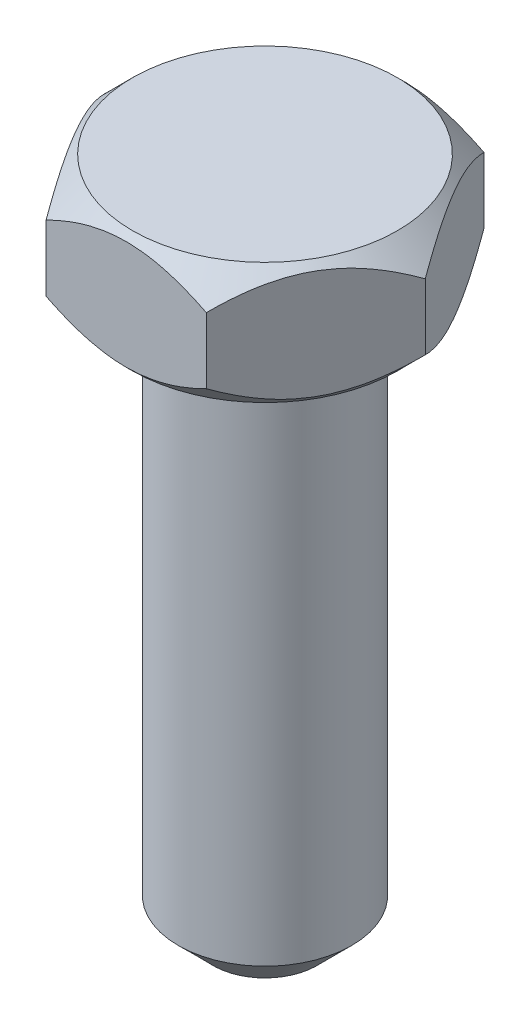
from build123d import *

# Parameters (mm, degrees)
EXTRUDE_1_DEPTH = 3.5
SKETCH_5_R      = 2.5
EXTRUDE_2_DEPTH = 16
CHAMFER_1_SIZE  = 1


with BuildPart() as part:
    # Эскиз1 → Вытянуть1 (new body)
    with BuildSketch(Plane(origin=(0, 0, 0), x_dir=(1, 0, 0), z_dir=(0, 1, 0))):
        Polygon((-2.309401077, 4), (2.309401077, 4), (4.618802154, 0), (2.309401077, -4), (-2.309401077, -4), (-4.618802154, 0), align=None)
    extrude(amount=-EXTRUDE_1_DEPTH)

    # Эскиз5 → Вытянуть2 (add)
    with BuildSketch(Plane.XZ.offset(3.5)):
        with Locations(Location((0, 0, 0), (0, 0, 90))):
            Circle(SKETCH_5_R)
    extrude(amount=EXTRUDE_2_DEPTH)

    # Фаска1
    chamfer_1_edges = [part.edges().sort_by_distance(p)[0] for p in [
        (0, -19.5, -2.5),
    ]]
    chamfer(chamfer_1_edges, length=CHAMFER_1_SIZE)

    # Эскиз4 → Вырез-Повернуть1 (revolve, cut)
    with BuildSketch(Plane.XY, mode=Mode.PRIVATE) as cut_revolve_1_sk:
        Polygon((-4.618802154, -0.8), (-3.818802154, 0), (-4.618802154, 0), align=None)
        Polygon((-4.618802154, -2.7), (-3.818802154, -3.5), (-4.618802154, -3.5), align=None)
    revolve(cut_revolve_1_sk.sketch.rotate(Axis((0, -3.5, 0), (0, -1, 0)), 120.000000119), axis=Axis((0, -3.5, 0), (0, -1, 0)), mode=Mode.SUBTRACT)


solid = part.part
